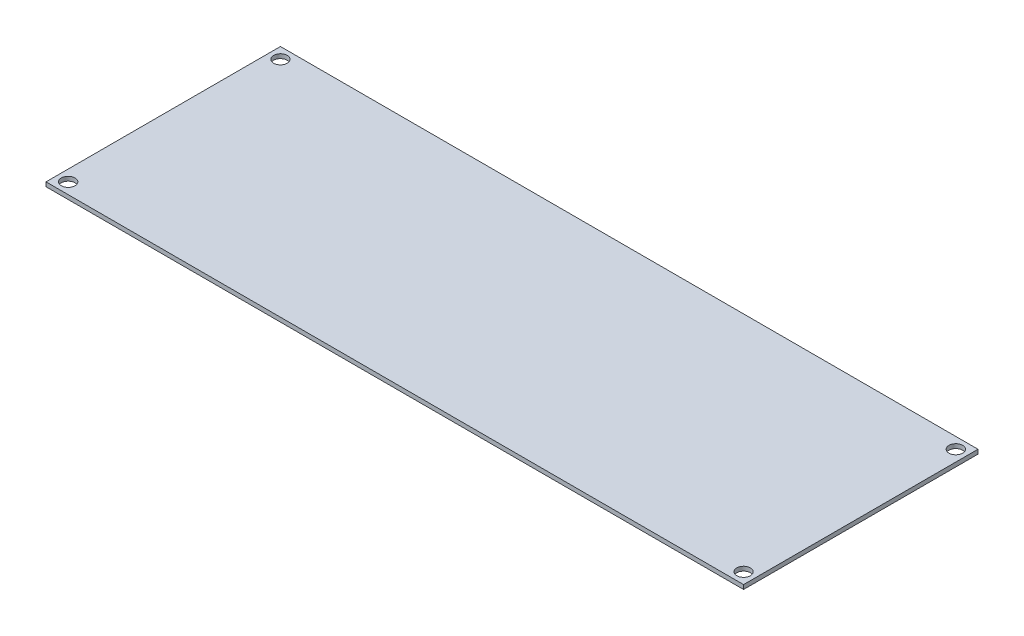
from build123d import *

# Parameters (mm, degrees)
SKETCH1_W           = 163.66
SKETCH1_H           = 55
SKETCH1_R           = 1.6
BOSS_EXTRUDE1_DEPTH = 1


with BuildPart() as part:
    # Sketch1 → Boss-Extrude1 (new body)
    with BuildSketch(Plane(origin=(0, 0, 0), x_dir=(1, 0, 0), z_dir=(0, 1, 0))):
        Rectangle(SKETCH1_W, SKETCH1_H)
        with Locations(Location((79.23, 24.9, 0), (0, 0, 270))):
            Circle(SKETCH1_R, mode=Mode.SUBTRACT)
        with Locations(Location((79.23, -24.9, 0), (0, 0, 270))):
            Circle(SKETCH1_R, mode=Mode.SUBTRACT)
        with Locations(Location((-79.23, -24.9, 0), (0, 0, 270))):
            Circle(SKETCH1_R, mode=Mode.SUBTRACT)
        with Locations(Location((-79.23, 24.9, 0), (0, 0, 270))):
            Circle(SKETCH1_R, mode=Mode.SUBTRACT)
    extrude(amount=BOSS_EXTRUDE1_DEPTH)


solid = part.part
